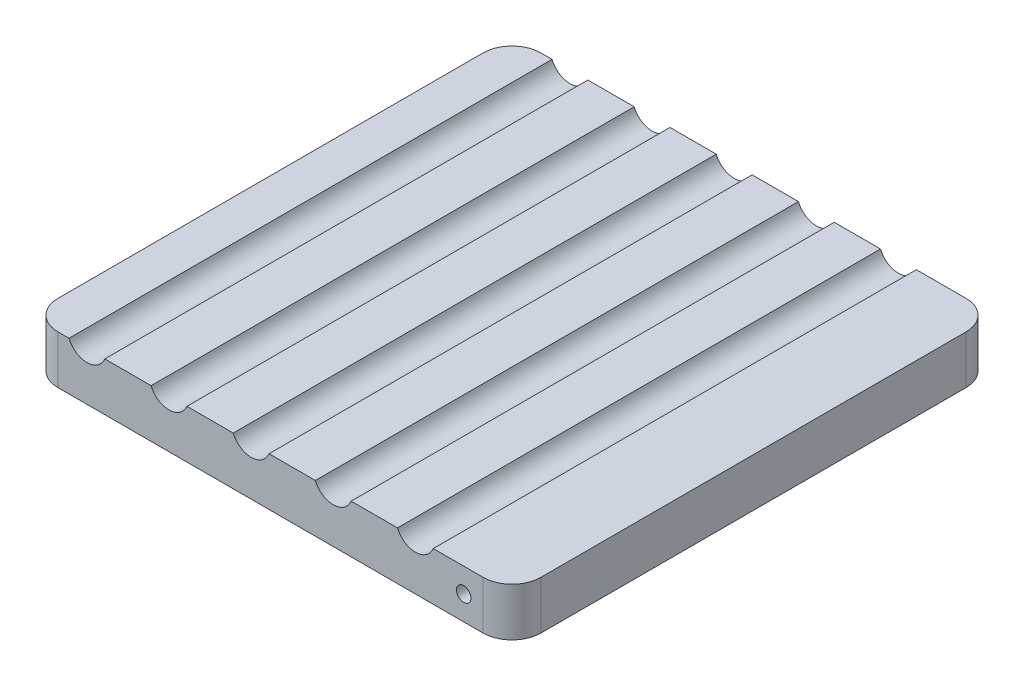
from build123d import *

# Parameters (mm, degrees)
SKETCH2_W           = 127
SKETCH2_H           = 127
BOSS_EXTRUDE1_DEPTH = 12.7
FILLET1_R           = 7.62
SKETCH3_R           = 5.08
CUT_EXTRUDE1_DEPTH  = 143.557146436
LPATTERN1_COUNT     = 5
LPATTERN1_PITCH     = 21.59
SKETCH3_3_R         = 1.905
SKETCH3_3_R_2       = 5.08
CUT_EXTRUDE2_DEPTH  = 143.557146436


with BuildPart() as part:
    # Sketch2 → Boss-Extrude1 (new body)
    with BuildSketch(Plane(origin=(0, 0, 0), x_dir=(1, 0, 0), z_dir=(0, 1, 0))):
        Rectangle(SKETCH2_W, SKETCH2_H)
    extrude(amount=BOSS_EXTRUDE1_DEPTH)

    # Fillet1
    fillet1_edges = [part.edges().sort_by_distance(p)[0] for p in [
        (-63.5, 6.35, -63.5),
        (-63.5, 6.35, 63.5),
        (63.5, 6.35, -63.5),
        (63.5, 6.35, 63.5),
    ]]
    fillet(fillet1_edges, radius=FILLET1_R)

    # Sketch3 → Cut-Extrude1 (cut, through all)
    with BuildSketch(Plane.XY.offset(63.5)):
        with Locations((38.1, 14.605)):
            Circle(SKETCH3_R)
    cut_extrude1 = extrude(amount=-CUT_EXTRUDE1_DEPTH, mode=Mode.SUBTRACT)

    # LPattern1: Cut-Extrude1 ×5
    with Locations(*[(-i * LPATTERN1_PITCH, 0, 0) for i in range(1, LPATTERN1_COUNT)]):
        add(cut_extrude1, mode=Mode.SUBTRACT)

    # Sketch3<3> → Cut-Extrude2 (cut, through all)
    with BuildSketch(Plane.XY.offset(63.5)):
        with Locations((50.8, 6.35)):
            Circle(SKETCH3_3_R)
        with Locations((38.1, 14.605)):
            Circle(SKETCH3_3_R_2)
    extrude(amount=-CUT_EXTRUDE2_DEPTH, mode=Mode.SUBTRACT)


solid = part.part
